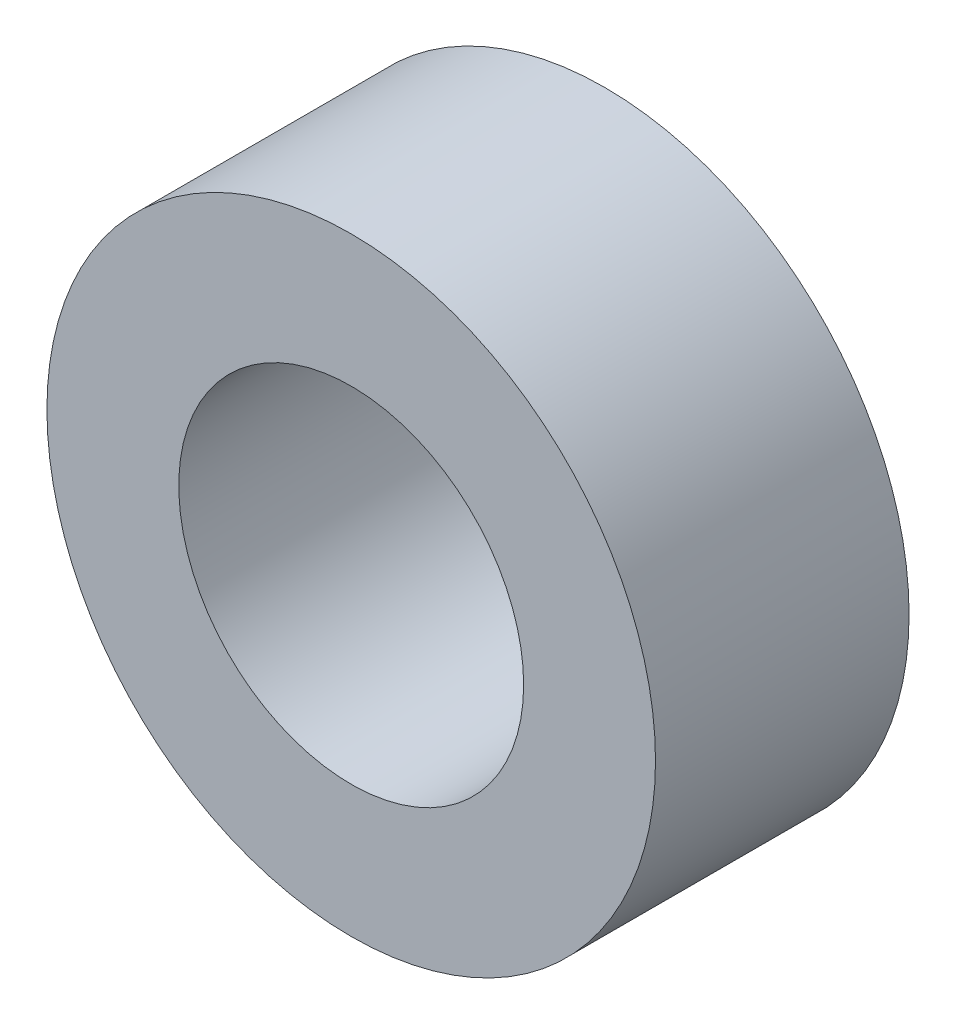
from build123d import *

# Parameters (mm, degrees)
MAIN_PROFILE_SKETCH_R   = 3
MAIN_PROFILE_SKETCH_R_2 = 1.7
MAIN_EXTRUSION_DEPTH    = 2.5


with BuildPart() as part:
    # Main Profile Sketch → Main Extrusion (new body)
    with BuildSketch(Plane.XY.offset(96.5)):
        with Locations((188.5, -40.5)):
            Circle(MAIN_PROFILE_SKETCH_R)
        with Locations((188.5, -40.5)):
            Circle(MAIN_PROFILE_SKETCH_R_2, mode=Mode.SUBTRACT)
    extrude(amount=-MAIN_EXTRUSION_DEPTH)


solid = part.part
